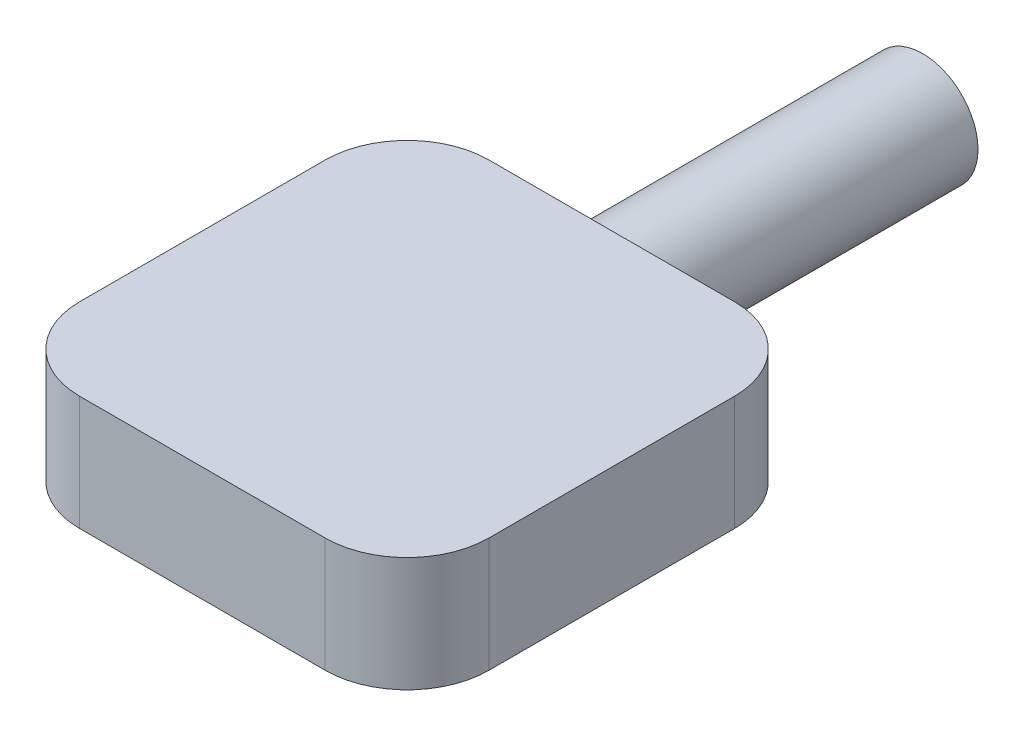
from build123d import *

# Parameters (mm, degrees)
BOSS_EXTRUDE1_DEPTH      = 73
BOSS_EXTRUDE1_DEPTH_BACK = 10
SKETCH1_R                = 6.75
BOSS_EXTRUDE2_DEPTH      = 7
BOSS_EXTRUDE2_DEPTH_BACK = 7


with BuildPart() as part:
    # Sketch1 → Boss-Extrude1 (new, two sides: drawn at the far end of the back side and taken through both)
    with BuildSketch(Plane.XY.offset(-BOSS_EXTRUDE1_DEPTH_BACK)):
        Circle(SKETCH1_R)
    extrude(amount=BOSS_EXTRUDE1_DEPTH + BOSS_EXTRUDE1_DEPTH_BACK)

    # Sketch2 → Boss-Extrude2 (add, two sides: drawn at the far end of the back side and taken through both)
    with BuildSketch(Plane(origin=(0, 0, 0), x_dir=(1, 0, 0), z_dir=(0, 1, 0)).offset(-BOSS_EXTRUDE2_DEPTH_BACK)):
        with BuildLine():
            Line((-15, -78), (15, -78))
            ThreePointArc((15, -78), (22.071067812, -75.071067812), (25, -68))
            Line((25, -68), (25, -38))
            ThreePointArc((25, -38), (22.071067812, -30.928932188), (15, -28))
            Line((15, -28), (-15, -28))
            ThreePointArc((-15, -28), (-22.071067812, -30.928932188), (-25, -38))
            Line((-25, -38), (-25, -68))
            ThreePointArc((-25, -68), (-22.071067812, -75.071067812), (-15, -78))
        make_face()
    extrude(amount=BOSS_EXTRUDE2_DEPTH + BOSS_EXTRUDE2_DEPTH_BACK)


solid = part.part
